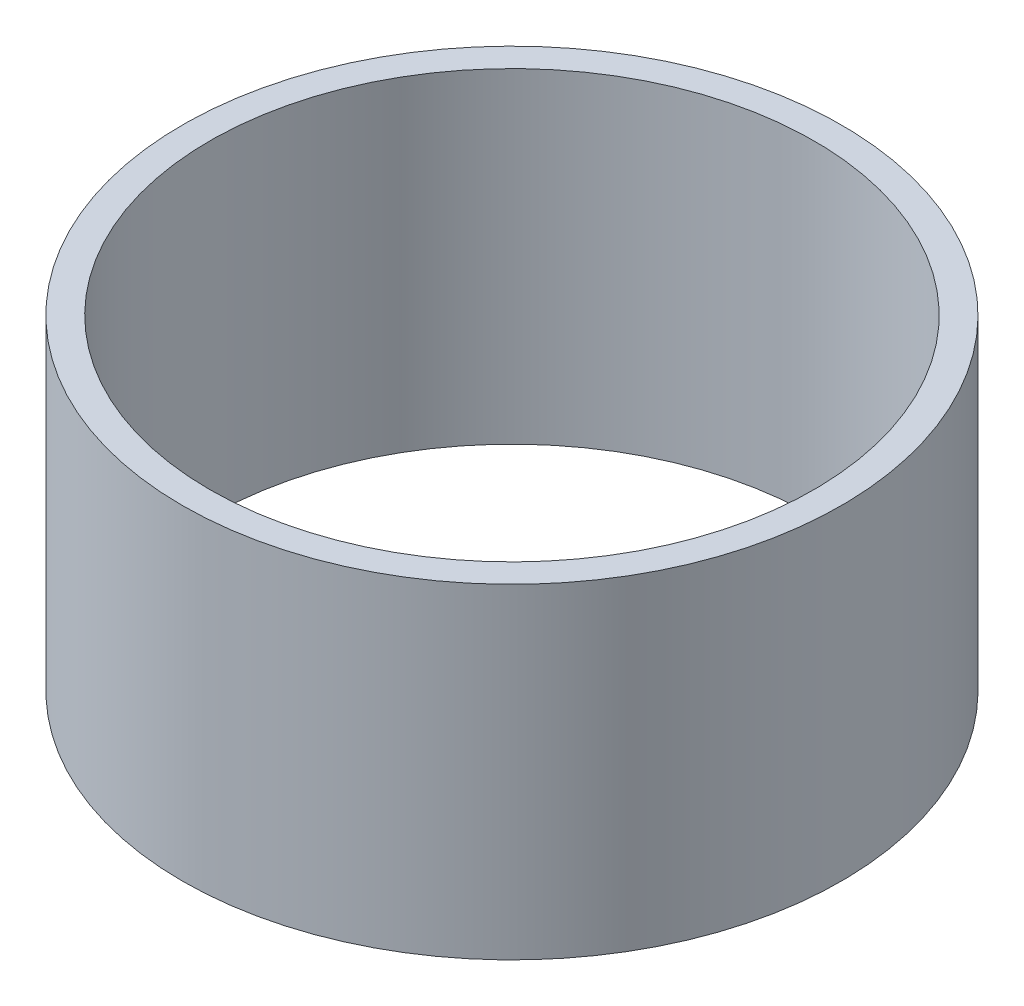
from build123d import *

# Parameters (mm, degrees)
SKETCH1_R           = 76.2
SKETCH1_R_2         = 69.85
BOSS_EXTRUDE1_DEPTH = 37.6047


with BuildPart() as part:
    # Sketch1 → Boss-Extrude1 (new, symmetric)
    with BuildSketch(Plane(origin=(0, 0, 0), x_dir=(1, 0, 0), z_dir=(0, 1, 0))):
        with Locations(Location((0, 0, 0), (0, 0, 270))):
            Circle(SKETCH1_R)
        with Locations(Location((0, 0, 0), (0, 0, 270))):
            Circle(SKETCH1_R_2, mode=Mode.SUBTRACT)
    extrude(amount=BOSS_EXTRUDE1_DEPTH, both=True)


solid = part.part
